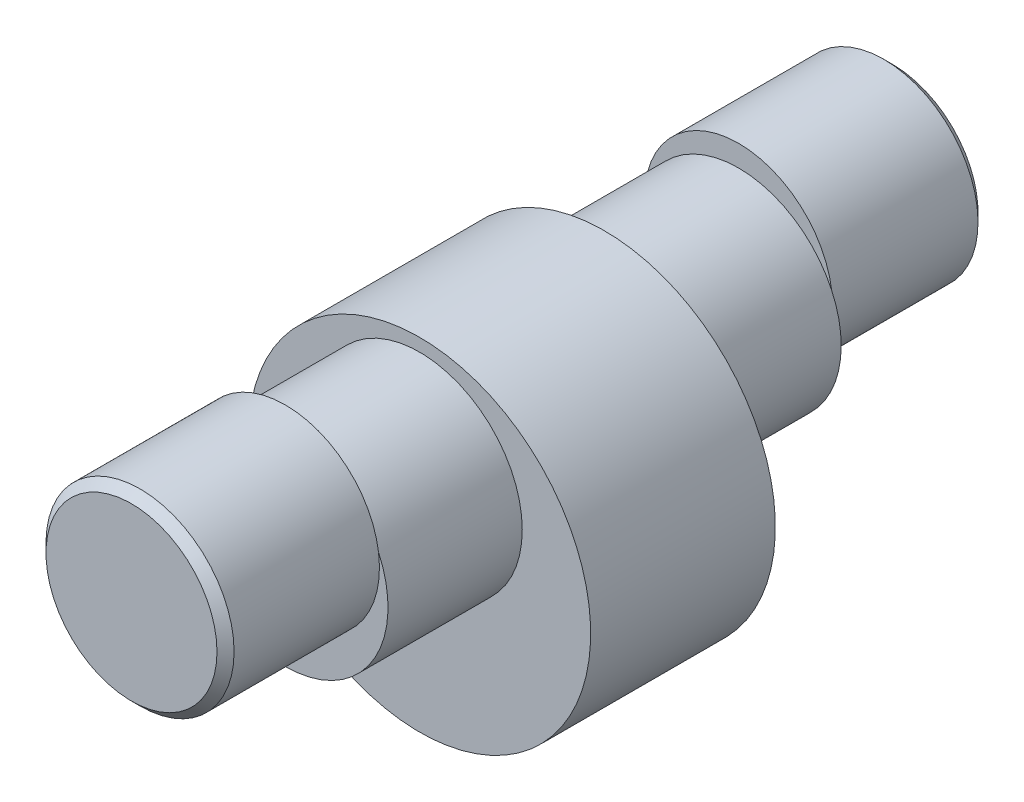
from build123d import *

# Parameters (mm, degrees)
ESQUISSE1_R                  = 20
EXTRUSION1_DEPTH             = 10.8
ESQUISSE2_R                  = 12
EXTRUSION2_DEPTH             = 15.7
ESQUISSE3_R                  = 11
EXTRUSION3_DEPTH             = 18
CHANFREIN1_SIZE              = 1
CHANFREIN1_OF_SYM_TRIE2_SIZE = 1


with BuildPart() as part:
    # Esquisse1 → Extrusion1 (new, symmetric)
    with BuildSketch(Plane.XY):
        with Locations(Location((0, 0, 0), (0, 0, 180))):
            Circle(ESQUISSE1_R)
    extrude(amount=EXTRUSION1_DEPTH, both=True)

    # Esquisse2 → Extrusion2 (add)
    with BuildSketch(Plane.XY.offset(10.8)):
        with Locations((0, 6.5)):
            Circle(ESQUISSE2_R)
    extrusion2 = extrude(amount=EXTRUSION2_DEPTH)

    # Esquisse3 → Extrusion3 (add)
    with BuildSketch(Plane.XY.offset(26.5)):
        with Locations(Location((0, 10, 0), (0, 0, 171.974698192))):
            Circle(ESQUISSE3_R)
    extrusion3 = extrude(amount=EXTRUSION3_DEPTH)

    # Chanfrein1
    chanfrein1_edges = [part.edges().sort_by_distance(p)[0] for p in [
        (10.892271647, 8.464285714, 44.5),
    ]]
    chamfer(chanfrein1_edges, length=CHANFREIN1_SIZE)

    # Symétrie2: Extrusion2, Extrusion3 across plane
    add(extrusion2.mirror(Plane.XY))
    add(extrusion3.mirror(Plane.XY))

    # Chanfrein1 of Symétrie2
    chanfrein1_of_sym_trie2_edges = [part.edges().sort_by_distance(p)[0] for p in [
        (10.892271647, 8.464285714, -44.5),
    ]]
    chamfer(chanfrein1_of_sym_trie2_edges, length=CHANFREIN1_OF_SYM_TRIE2_SIZE)


solid = part.part
